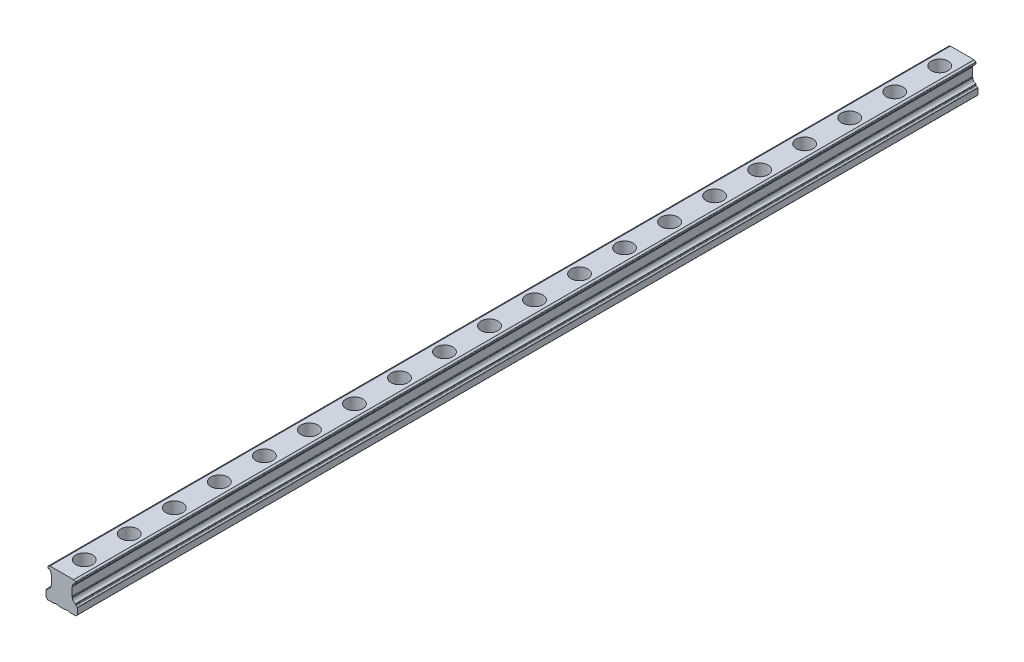
from build123d import *

# Parameters (mm, degrees)
Y_KSEKLIK_EKSTR_ZYON1_DEPTH = 400
L_O_ALTMA1_COUNT            = 20
L_O_ALTMA1_PITCH            = 40


with BuildPart() as part:
    # Çizim1 → Yükseklik-Ekstrüzyon1 (new, symmetric)
    with BuildSketch(Plane.XY):
        with BuildLine():
            Line((-8.9, 6.985786438), (-8.9, -0.185786438))
            ThreePointArc((-8.9, -0.185786438), (-8.94567228, -0.415396497), (-9.075735931, -0.610050506))
            Line((-9.075735931, -0.610050506), (-9.282842712, -0.817157288))
            ThreePointArc((-9.282842712, -0.817157288), (-9.369551813, -0.946926627), (-9.4, -1.1))
            ThreePointArc((-9.4, -1.1), (-10.175, -3.150457266), (-12.1125, -4.175685899))
            ThreePointArc((-12.1125, -4.175685899), (-12.175, -4.208757791), (-12.2, -4.274901573))
            Line((-12.2, -4.274901573), (-12.2, -5.131146833))
            ThreePointArc((-12.2, -5.131146833), (-12.308508773, -5.475292694), (-12.594787914, -5.694962405))
            Line((-12.594787914, -5.694962405), (-13.736808057, -6.110623744))
            ThreePointArc((-13.736808057, -6.110623744), (-13.927660818, -6.257070218), (-14, -6.486500793))
            Line((-14, -6.486500793), (-14, -11.792893219))
            ThreePointArc((-14, -11.792893219), (-13.969551813, -11.945966592), (-13.882842712, -12.075735931))
            Line((-13.882842712, -12.075735931), (-12.575735931, -13.382842712))
            ThreePointArc((-12.575735931, -13.382842712), (-12.445966592, -13.469551813), (-12.292893219, -13.5))
            Line((-12.292893219, -13.5), (-6.727106781, -13.5))
            ThreePointArc((-6.727106781, -13.5), (-6.535765065, -13.461939766), (-6.373553391, -13.353553391))
            Line((-6.373553391, -13.353553391), (-6.116446609, -13.096446609))
            ThreePointArc((-6.116446609, -13.096446609), (-5.954234935, -12.988060234), (-5.762893219, -12.95))
            Line((-5.762893219, -12.95), (-3.577106781, -12.95))
            ThreePointArc((-3.577106781, -12.95), (-3.385765065, -12.988060234), (-3.223553391, -13.096446609))
            Line((-3.223553391, -13.096446609), (-2.966446609, -13.353553391))
            ThreePointArc((-2.966446609, -13.353553391), (-2.804234935, -13.461939766), (-2.612893219, -13.5))
            Line((-2.612893219, -13.5), (2.612893219, -13.5))
            ThreePointArc((2.612893219, -13.5), (2.804234935, -13.461939766), (2.966446609, -13.353553391))
            Line((2.966446609, -13.353553391), (3.223553391, -13.096446609))
            ThreePointArc((3.223553391, -13.096446609), (3.385765065, -12.988060234), (3.577106781, -12.95))
            Line((3.577106781, -12.95), (5.762893219, -12.95))
            ThreePointArc((5.762893219, -12.95), (5.954234935, -12.988060234), (6.116446609, -13.096446609))
            Line((6.116446609, -13.096446609), (6.373553391, -13.353553391))
            ThreePointArc((6.373553391, -13.353553391), (6.535765065, -13.461939766), (6.727106781, -13.5))
            Line((6.727106781, -13.5), (12.292893219, -13.5))
            ThreePointArc((12.292893219, -13.5), (12.445966592, -13.469551813), (12.575735931, -13.382842712))
            Line((12.575735931, -13.382842712), (13.882842712, -12.075735931))
            ThreePointArc((13.882842712, -12.075735931), (13.969551813, -11.945966592), (14, -11.792893219))
            Line((14, -11.792893219), (14, -6.486500793))
            ThreePointArc((14, -6.486500793), (13.927660818, -6.257070218), (13.736808057, -6.110623744))
            Line((13.736808057, -6.110623744), (12.594787914, -5.694962405))
            ThreePointArc((12.594787914, -5.694962405), (12.308508773, -5.475292694), (12.2, -5.131146833))
            Line((12.2, -5.131146833), (12.2, -4.274901573))
            ThreePointArc((12.2, -4.274901573), (12.175, -4.208757791), (12.1125, -4.175685899))
            ThreePointArc((12.1125, -4.175685899), (10.175, -3.150457266), (9.4, -1.1))
            ThreePointArc((9.4, -1.1), (9.369551813, -0.946926627), (9.282842712, -0.817157288))
            Line((9.282842712, -0.817157288), (9.075735931, -0.610050506))
            ThreePointArc((9.075735931, -0.610050506), (8.94567228, -0.415396497), (8.9, -0.185786438))
            Line((8.9, -0.185786438), (8.9, 6.985786438))
            ThreePointArc((8.9, 6.985786438), (8.94567228, 7.215396497), (9.075735931, 7.410050506))
            Line((9.075735931, 7.410050506), (9.282842712, 7.617157288))
            ThreePointArc((9.282842712, 7.617157288), (9.369551813, 7.746926627), (9.4, 7.9))
            ThreePointArc((9.4, 7.9), (10.178917442, 9.954890692), (12.124242424, 10.977142545))
            ThreePointArc((12.124242424, 10.977142545), (12.249747262, 11.043094278), (12.3, 11.175667871))
            Line((12.3, 11.175667871), (12.3, 12.253589838))
            ThreePointArc((12.3, 12.253589838), (12.246410162, 12.453589838), (12.1, 12.6))
            Line((12.1, 12.6), (10.633974596, 13.446410162))
            ThreePointArc((10.633974596, 13.446410162), (10.537502214, 13.486370331), (10.433974596, 13.5))
            Line((10.433974596, 13.5), (-10.433974596, 13.5))
            ThreePointArc((-10.433974596, 13.5), (-10.537502214, 13.486370331), (-10.633974596, 13.446410162))
            Line((-10.633974596, 13.446410162), (-12.1, 12.6))
            ThreePointArc((-12.1, 12.6), (-12.246410162, 12.453589838), (-12.3, 12.253589838))
            Line((-12.3, 12.253589838), (-12.3, 11.175667871))
            ThreePointArc((-12.3, 11.175667871), (-12.249747262, 11.043094278), (-12.124242424, 10.977142545))
            ThreePointArc((-12.124242424, 10.977142545), (-10.178917442, 9.954890692), (-9.4, 7.9))
            ThreePointArc((-9.4, 7.9), (-9.369551813, 7.746926627), (-9.282842712, 7.617157288))
            Line((-9.282842712, 7.617157288), (-9.075735931, 7.410050506))
            ThreePointArc((-9.075735931, 7.410050506), (-8.94567228, 7.215396497), (-8.9, 6.985786438))
        make_face()
    extrude(amount=Y_KSEKLIK_EKSTR_ZYON1_DEPTH, both=True)

    # Çizim2 → M8 Altıgen Alyan Başlı Kör Vida İçin Havşa1 (revolve, cut)
    with BuildSketch(Plane(origin=(0, 13.5, 380), x_dir=(0, 0, 1), z_dir=(1, 0, 0))):
        Polygon((0, 0), (0, 33.953872786), (4.5, 31.25), (4.5, 13.6), (7.5, 13.6), (7.5, 0), align=None)
    m8_alt_gen_alyan_ba_l_k_r_vida_in_hav = revolve(axis=Axis((0, 19.85, 380), (0, -1, 0)), mode=Mode.SUBTRACT)

    # LÇoğaltma1: M8 Altıgen Alyan Başlı Kör Vida İçin Havşa1 ×20
    with Locations(*[(0, 0, -i * L_O_ALTMA1_PITCH) for i in range(1, L_O_ALTMA1_COUNT)]):
        add(m8_alt_gen_alyan_ba_l_k_r_vida_in_hav, mode=Mode.SUBTRACT)


solid = part.part
